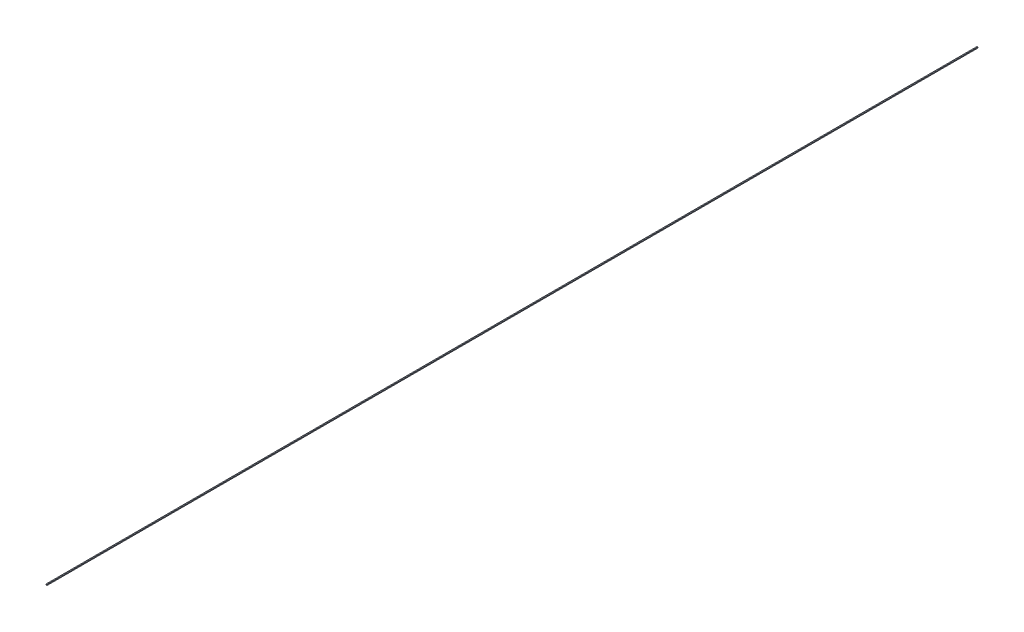
from build123d import *

# Parameters (mm, degrees)
SKETCH1_W      = 2.54
SKETCH1_H      = 2.54
EXTRUDE1_DEPTH = 2540


with BuildPart() as part:
    # Sketch1 → Extrude1 (new body)
    with BuildSketch(Plane.XY):
        with Locations((1.27, 1.27)):
            Rectangle(SKETCH1_W, SKETCH1_H)
    extrude(amount=EXTRUDE1_DEPTH)


solid = part.part
